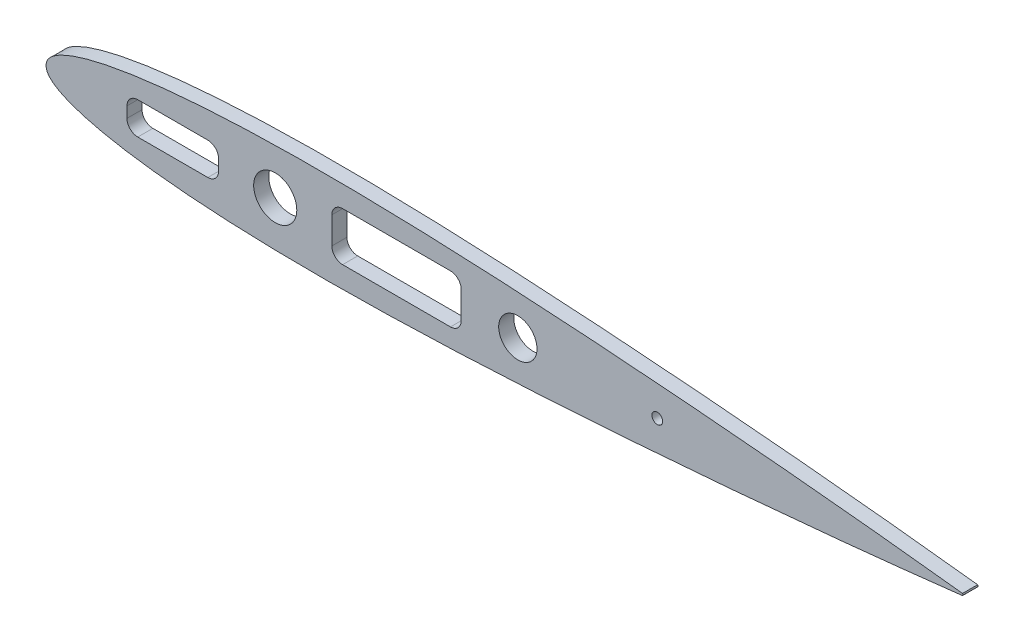
from build123d import *

# Parameters (mm, degrees)
SKETCH_1_R      = 4
SKETCH_1_R_2    = 3.55
SKETCH_1_R_3    = 1
EXTRUDE_1_DEPTH = 1.4


with BuildPart() as part:
    # Эскиз1 → Бобышка-Вытянуть1 (new, symmetric)
    with BuildSketch(Plane.XY):
        with BuildLine():
            ThreePointArc((280, 0.1785), (280.073937121, 0), (280, -0.1785))
            add(Edge.make_bspline(
                [(110, 0), (110.027578176, -0.23672144), (110.085538218, -0.73423022), (110.530223642, -1.427069758), (111.196336341, -2.078555233), (112.109835923, -2.701306388), (113.256788366, -3.299309238), (114.63793972, -3.873060466), (116.247665798, -4.421392386), (118.081312133, -4.942567641), (120.133109351, -5.434797476), (122.397158974, -5.896120566), (124.867245825, -6.324666077), (127.536961089, -6.718650341), (130.399721686, -7.07642431), (133.448762895, -7.396480569), (136.677139412, -7.677604542), (140.077743555, -7.918678943), (143.643266298, -8.118975561), (147.366223919, -8.277985977), (151.238917925, -8.395506076), (155.253439756, -8.471528808), (159.401643404, -8.506522967), (163.675147454, -8.5010027), (168.065295924, -8.455953662), (172.563150272, -8.372486564), (177.159453511, -8.251957682), (181.844626933, -8.095958493), (186.608700127, -7.906218293), (191.441311474, -7.684604439), (196.331634567, -7.433105337), (201.268368917, -7.153826886), (206.239642946, -6.848873), (211.232977593, -6.52047435), (216.235178286, -6.170864577), (221.232257467, -5.802244475), (226.209311114, -5.416958265), (231.150377303, -5.017351103), (236.038226964, -4.605811749), (240.854179313, -4.184912649), (247.071089236, -3.62220531), (253.116111921, -3.047869044), (258.952644662, -2.467188138), (263.047743378, -2.047856604), (266.898988862, -1.642607304), (270.455833183, -1.258590905), (273.651166984, -0.905304265), (276.385426802, -0.596436482), (278.45259621, -0.358958361), (279.592043704, -0.226075898), (280, -0.1785)],
                knots=[0, 0, 0, 0, 0.004099011, 0.008614742, 0.013934855, 0.020277775, 0.027752981, 0.036410215, 0.046266433, 0.057320238, 0.069558946, 0.082962861, 0.097507218, 0.113164082, 0.12990269, 0.147690304, 0.166492185, 0.186271967, 0.206991861, 0.228612215, 0.251092165, 0.274388983, 0.298458209, 0.323253842, 0.348727971, 0.374830387, 0.40150919, 0.428710016, 0.456376154, 0.484448083, 0.512863887, 0.541558094, 0.570462313, 0.599504248, 0.628607349, 0.657690446, 0.686667237, 0.715444849, 0.743923546, 0.77199483, 0.799540253, 0.852512115, 0.877624446, 0.901571134, 0.924121062, 0.944988816, 0.963803939, 0.980044339, 0.992855276, 1, 1, 1, 1], degree=3))
            add(Edge.make_bspline(
                [(280, 0.1785), (279.592043704, 0.226075898), (278.45259621, 0.358958361), (276.385426802, 0.596436482), (273.651166984, 0.905304265), (270.455833183, 1.258590905), (266.898988862, 1.642607304), (263.047743378, 2.047856604), (258.952644662, 2.467188138), (253.116111921, 3.047869044), (247.071089236, 3.62220531), (240.854179313, 4.184912649), (236.038226964, 4.605811749), (231.150377303, 5.017351103), (226.209311114, 5.416958265), (221.232257467, 5.802244475), (216.235178286, 6.170864577), (211.232977593, 6.52047435), (206.239642946, 6.848873), (201.268368917, 7.153826886), (196.331634567, 7.433105337), (191.441311474, 7.684604439), (186.608700127, 7.906218293), (181.844626933, 8.095958493), (177.159453511, 8.251957682), (172.563150272, 8.372486564), (168.065295924, 8.455953662), (163.675147454, 8.5010027), (159.401643404, 8.506522967), (155.253439756, 8.471528808), (151.238917925, 8.395506076), (147.366223919, 8.277985977), (143.643266298, 8.118975561), (140.077743555, 7.918678943), (136.677139412, 7.677604542), (133.448762895, 7.396480569), (130.399721686, 7.07642431), (127.536961089, 6.718650341), (124.867245825, 6.324666077), (122.397158974, 5.896120566), (120.133109351, 5.434797476), (118.081312133, 4.942567641), (116.247665798, 4.421392386), (114.63793972, 3.873060466), (113.256788366, 3.299309238), (112.109835923, 2.701306388), (111.196336341, 2.078555233), (110.530223642, 1.427069758), (110.085538218, 0.73423022), (110.027578176, 0.23672144), (110, 0)],
                knots=[0, 0, 0, 0, 0.007144724, 0.019955661, 0.036196061, 0.055011184, 0.075878938, 0.098428866, 0.122375554, 0.147487885, 0.200459747, 0.22800517, 0.256076454, 0.284555151, 0.313332763, 0.342309554, 0.371392651, 0.400495752, 0.429537687, 0.458441906, 0.487136113, 0.515551917, 0.543623846, 0.571289984, 0.59849081, 0.625169613, 0.651272029, 0.676746158, 0.701541791, 0.725611017, 0.748907835, 0.771387785, 0.793008139, 0.813728033, 0.833507815, 0.852309696, 0.87009731, 0.886835918, 0.902492782, 0.917037139, 0.930441054, 0.942679762, 0.953733567, 0.963589785, 0.972247019, 0.979722225, 0.986065145, 0.991385258, 0.995900989, 1, 1, 1, 1], degree=3))
        make_face()
        with Locations((152.51848428, 0)):
            Circle(SKETCH_1_R, mode=Mode.SUBTRACT)
        with Locations((197.51848428, 0)):
            Circle(SKETCH_1_R_2, mode=Mode.SUBTRACT)
        with Locations((223.382624747, 0)):
            Circle(SKETCH_1_R_3, mode=Mode.SUBTRACT)
        with BuildLine():
            Line((127.01848428, -3), (140.01848428, -3))
            ThreePointArc((140.01848428, -3), (141.432697843, -2.414213562), (142.01848428, -1))
            Line((142.01848428, -1), (142.01848428, 1))
            ThreePointArc((142.01848428, 1), (141.432697843, 2.414213562), (140.01848428, 3))
            Line((140.01848428, 3), (127.01848428, 3))
            ThreePointArc((127.01848428, 3), (125.604270718, 2.414213562), (125.01848428, 1))
            Line((125.01848428, 1), (125.01848428, -1))
            ThreePointArc((125.01848428, -1), (125.604270718, -2.414213562), (127.01848428, -3))
        make_face(mode=Mode.SUBTRACT)
        with BuildLine():
            Line((165.01848428, -4.5), (185.01848428, -4.5))
            ThreePointArc((185.01848428, -4.5), (186.432697843, -3.914213562), (187.01848428, -2.5))
            Line((187.01848428, -2.5), (187.01848428, 2.5))
            ThreePointArc((187.01848428, 2.5), (186.432697843, 3.914213562), (185.01848428, 4.5))
            Line((185.01848428, 4.5), (165.01848428, 4.5))
            ThreePointArc((165.01848428, 4.5), (163.604270718, 3.914213562), (163.01848428, 2.5))
            Line((163.01848428, 2.5), (163.01848428, -2.5))
            ThreePointArc((163.01848428, -2.5), (163.604270718, -3.914213562), (165.01848428, -4.5))
        make_face(mode=Mode.SUBTRACT)
    extrude(amount=EXTRUDE_1_DEPTH, both=True)


solid = part.part
